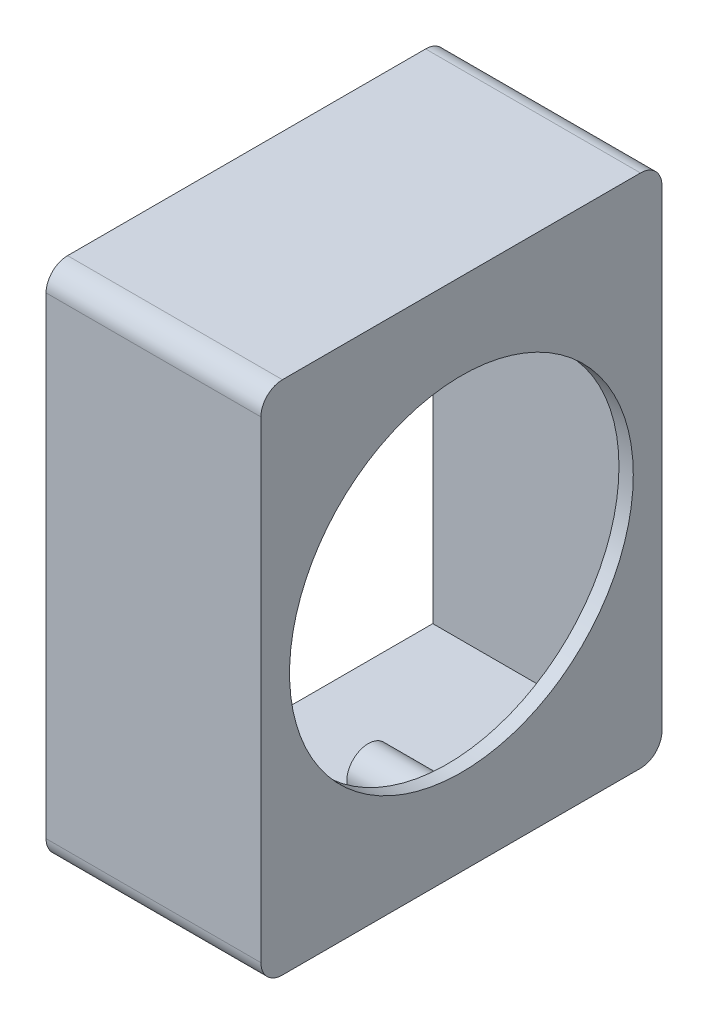
from build123d import *

# Parameters (mm, degrees)
SKETCH1_W           = 36
SKETCH1_H           = 34
BOSS_EXTRUDE6_DEPTH = 1
SKETCH7_R           = 12
CUT_EXTRUDE1_DEPTH  = 1
EXTRUDE_THIN1_DEPTH = 15
SKETCH10_W          = 6.466905847
SKETCH10_H          = 48.062044255
CUT_EXTRUDE2_DEPTH  = 29.948229652
SKETCH11_W          = 36
SKETCH11_H          = 1
EXTRUDE_THIN2_DEPTH = 14
FILLET3_R           = 1.5
SKETCH12_R          = 1.5
BOSS_EXTRUDE7_DEPTH = 5
SKETCH13_R          = 1
CUT_EXTRUDE3_DEPTH  = 5


with BuildPart() as part:
    # Sketch1 → Boss-Extrude6 (new body)
    with BuildSketch(Plane.YZ):
        Rectangle(SKETCH1_W, SKETCH1_H)
    extrude(amount=BOSS_EXTRUDE6_DEPTH)

    # Sketch7 → Cut-Extrude1 (cut)
    with BuildSketch(Plane.YZ.offset(1)):
        with Locations(Location((0, 3, 0), (0, 0, 270))):
            Circle(SKETCH7_R)
    extrude(amount=-CUT_EXTRUDE1_DEPTH, mode=Mode.SUBTRACT)

    # Sketch9 → Extrude-Thin1 (add)
    with BuildSketch(Plane(origin=(1, 0, 0), x_dir=(0, 0, -1), z_dir=(1, 0, 0))):
        Polygon((17, -18), (-17, -18), (-17, 18), (17, 18), (17, 17), (-16, 17), (-16, -17), (17, -17), align=None)
    extrude(amount=-EXTRUDE_THIN1_DEPTH)

    # Sketch10 → Cut-Extrude2 (cut, through all)
    with BuildSketch(Plane(origin=(1, 0, 0), x_dir=(0, 0, -1), z_dir=(1, 0, 0))):
        with Locations((14.233452923, -0.025867623)):
            Rectangle(SKETCH10_W, SKETCH10_H)
    extrude(amount=-CUT_EXTRUDE2_DEPTH, mode=Mode.SUBTRACT)

    # Sketch11 → Extrude-Thin2 (add)
    with BuildSketch(Plane.YZ):
        with Locations((0, -10.5)):
            Rectangle(SKETCH11_W, SKETCH11_H)
    extrude(amount=-EXTRUDE_THIN2_DEPTH)

    # Fillet3
    fillet3_edges = [part.edges().sort_by_distance(p)[0] for p in [
        (-6.5, 18, -11),
        (-6.5, -18, -11),
        (-6.5, -18, 17),
        (-6.5, 18, 17),
    ]]
    fillet(fillet3_edges, radius=FILLET3_R)

    # Sketch12 → Boss-Extrude7 (add)
    with BuildSketch(Plane.YZ):
        with Locations(Location((-14.5, 3.5, 0), (0, 0, 270))):
            Circle(SKETCH12_R)
    boss_extrude7 = extrude(amount=-BOSS_EXTRUDE7_DEPTH)

    # Sketch13 → Cut-Extrude3 (cut)
    with BuildSketch(Plane(origin=(-5, 0, 0), x_dir=(0, -1, 0), z_dir=(-1, 0, 0))):
        with Locations(Location((14.5, 3.5, 0), (0, 0, 90))):
            Circle(SKETCH13_R)
    cut_extrude3 = extrude(amount=-CUT_EXTRUDE3_DEPTH, mode=Mode.SUBTRACT)

    # Mirror1: Boss-Extrude7, Cut-Extrude3 across plane
    add(boss_extrude7.mirror(Plane.ZX))
    add(cut_extrude3.mirror(Plane.ZX), mode=Mode.SUBTRACT)


solid = part.part
